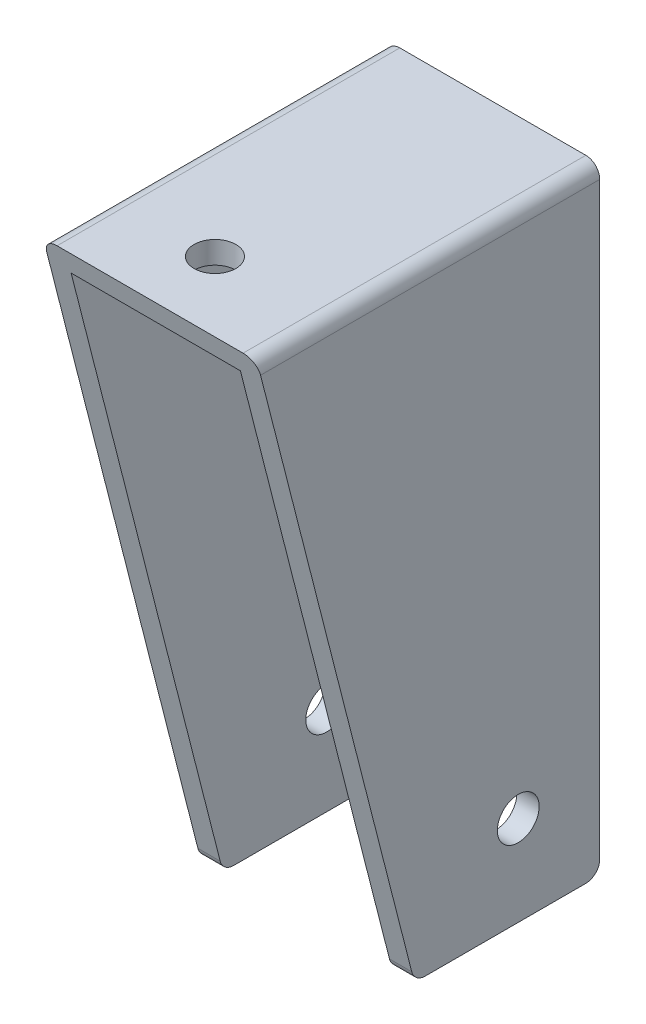
from build123d import *

# Parameters (mm, degrees)
BOSS_EXTRU_1_DEPTH      = 15.35
ESQUISSE2_W             = 12.15
ESQUISSE2_H             = 42.66
ENL_V_MAT_EXTRU_1_DEPTH = 53.912475845
CONG_1_R                = 1
ESQUISSE3_R             = 1.5
ENL_V_MAT_EXTRU_2_DEPTH = 53.912475845
ESQUISSE4_R             = 1.5
ENL_V_MAT_EXTRU_3_DEPTH = 53.912475845


with BuildPart() as part:
    # Esquisse1 → Boss.-Extru.1 (new body)
    with BuildSketch(Plane(origin=(0, 0, 0), x_dir=(0, 0, -1), z_dir=(1, 0, 0))):
        Polygon((0, 0), (0, 44.26), (-24.6, 44.26), (-13.3, 0), align=None)
    extrude(amount=BOSS_EXTRU_1_DEPTH)

    # Esquisse2 → Enlèv. mat.-Extru.1 (cut, through all)
    with BuildSketch(Plane(origin=(0, 0, 0), x_dir=(-1, 0, 0), z_dir=(0, 0, -1))):
        with Locations((-7.675, 21.33)):
            Rectangle(ESQUISSE2_W, ESQUISSE2_H)
    extrude(amount=-ENL_V_MAT_EXTRU_1_DEPTH, mode=Mode.SUBTRACT)

    # Congé1
    cong_1_edges = [part.edges().sort_by_distance(p)[0] for p in [
        (15.35, 44.26, 12.3),
        (0.8, 0, 13.3),
        (0.8, 0, 0),
        (0, 44.26, 12.3),
        (14.55, 0, 13.3),
        (14.55, 0, 0),
    ]]
    fillet(cong_1_edges, radius=CONG_1_R)

    # Esquisse3 → Enlèv. mat.-Extru.2 (cut, through all)
    with BuildSketch(Plane.ZY):
        with Locations((5.85, 6.46)):
            Circle(ESQUISSE3_R)
    extrude(amount=-ENL_V_MAT_EXTRU_2_DEPTH, mode=Mode.SUBTRACT)

    # Esquisse4 → Enlèv. mat.-Extru.3 (cut, through all)
    with BuildSketch(Plane(origin=(0, 44.26, 0), x_dir=(1, 0, 0), z_dir=(0, 1, 0))):
        with Locations(Location((7.331518895, -19.6, 0), (0, 0, 270))):
            Circle(ESQUISSE4_R)
    extrude(amount=-ENL_V_MAT_EXTRU_3_DEPTH, mode=Mode.SUBTRACT)


solid = part.part
